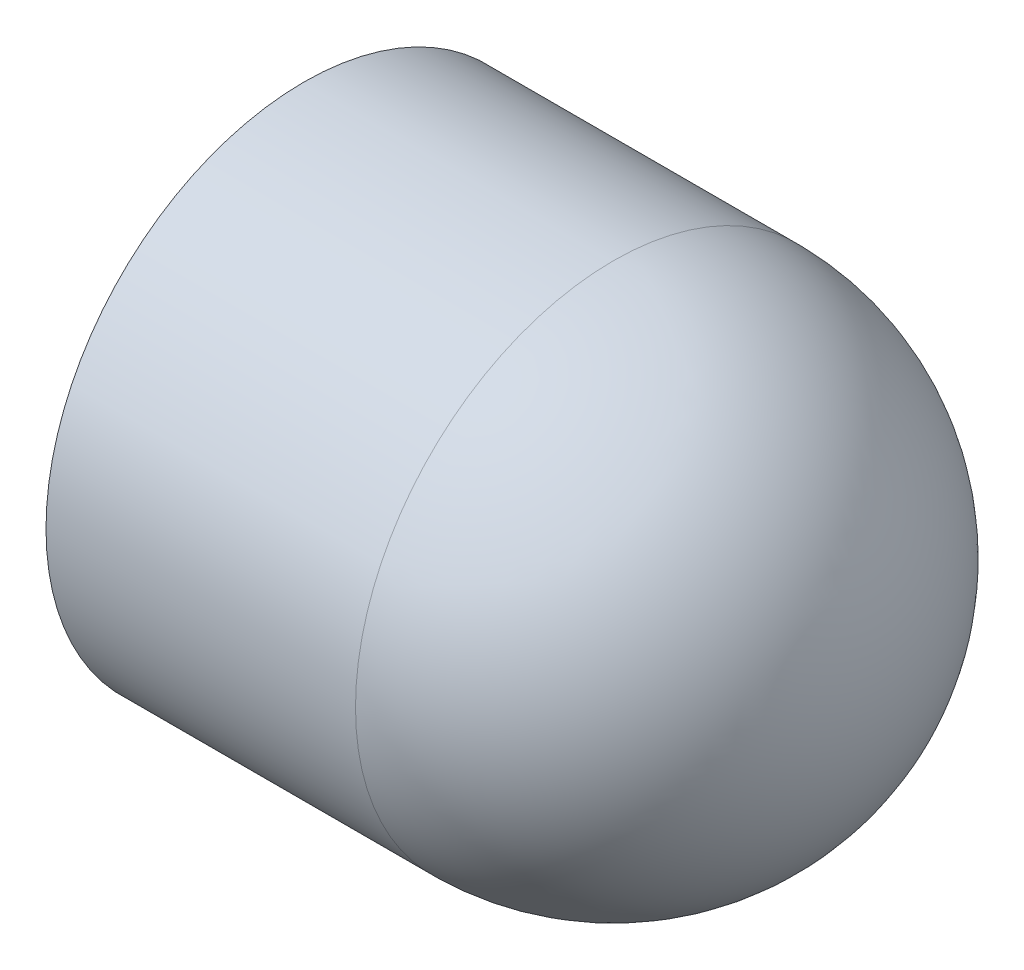
from build123d import *

# Parameters (mm, degrees)
SKETCH1_R           = 25
BOSS_EXTRUDE1_DEPTH = 15
SKETCH2_R           = 25
BOSS_EXTRUDE2_DEPTH = 40
FILLET1_R           = 25


with BuildPart() as part:
    # Sketch1 → Boss-Extrude1 (new body)
    with BuildSketch(Plane(origin=(0, 0, 0), x_dir=(0, 0, -1), z_dir=(1, 0, 0))):
        Circle(SKETCH1_R)
        with BuildLine():
            Line((-2.5, 10), (2.5, 10))
            Line((2.5, 10), (2.5, 7.599342077))
            ThreePointArc((2.5, 7.599342077), (0, -8), (-2.5, 7.599342077))
            Line((-2.5, 7.599342077), (-2.5, 10))
        make_face(mode=Mode.SUBTRACT)
    extrude(amount=BOSS_EXTRUDE1_DEPTH)

    # Sketch2 → Boss-Extrude2 (add)
    with BuildSketch(Plane(origin=(15, 0, 0), x_dir=(0, 0, -1), z_dir=(1, 0, 0))):
        Circle(SKETCH2_R)
    extrude(amount=BOSS_EXTRUDE2_DEPTH)

    # Fillet1
    fillet1_edges = [part.edges().sort_by_distance(p)[0] for p in [
        (55, 0, 25),
    ]]
    fillet(fillet1_edges, radius=FILLET1_R)


solid = part.part
